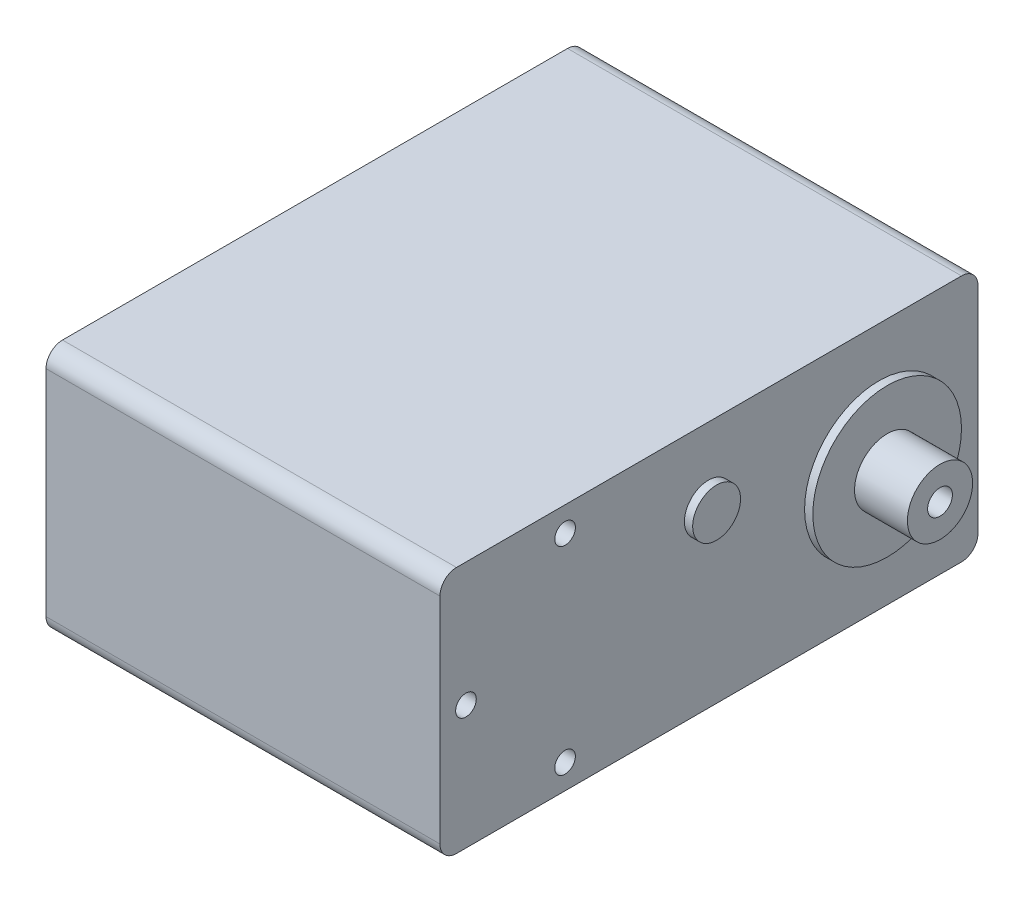
from build123d import *

# Parameters (mm, degrees)
ESQUISSE1_W                         = 47.7
ESQUISSE1_H                         = 65.15
BOSS_EXTRU_1_DEPTH                  = 15
ESQUISSE2_R                         = 9
BOSS_EXTRU_2_DEPTH                  = 1
ESQUISSE3_R                         = 3.95
BOSS_EXTRU_3_DEPTH                  = 6.4
ESQUISSE4_R                         = 4
BOSS_EXTRU_4_DEPTH                  = 0.5
ESQUISSE5_R                         = 3
BOSS_EXTRU_5_DEPTH                  = 5.5
ESQUISSE6_R                         = 2.9
BOSS_EXTRU_6_DEPTH                  = 1
ESQUISSE7_W                         = 4.4
ESQUISSE7_H                         = 6.9
BOSS_EXTRU_7_DEPTH                  = 3.8
ESQUISSE8_R                         = 0.75
BOSS_EXTRU_8_DEPTH                  = 5
DIAM_TRE_DU_PER_AGE_3_0_3_1_D       = 3
DIAM_TRE_DU_PER_AGE_3_0_3_1_DEPTH   = 6.2
DIAM_TRE_DU_PER_AGE_3_0_3_1_TIP     = 0.901290929
DIAM_TRE_DU_PER_AGE_2_5_2_5_1_D     = 2.5
DIAM_TRE_DU_PER_AGE_2_5_2_5_1_DEPTH = 6.2
DIAM_TRE_DU_PER_AGE_2_5_2_5_1_TIP   = 0.751075774
DIAM_TRE_DU_PER_AGE_2_5_2_5_2_D     = 2.5
DIAM_TRE_DU_PER_AGE_2_5_2_5_2_DEPTH = 6.2
DIAM_TRE_DU_PER_AGE_2_5_2_5_2_TIP   = 0.751075774
CONG_1_R                            = 2


with BuildPart() as part:
    # Esquisse1 → Boss.-Extru.1 (new, symmetric)
    with BuildSketch(Plane(origin=(0, 0, 0), x_dir=(1, 0, 0), z_dir=(0, 1, 0))):
        Rectangle(ESQUISSE1_W, ESQUISSE1_H)
    extrude(amount=BOSS_EXTRU_1_DEPTH, both=True)

    # Esquisse2 → Boss.-Extru.2 (add)
    with BuildSketch(Plane(origin=(23.85, 0, 0), x_dir=(0, 0, -1), z_dir=(1, 0, 0))):
        with Locations((20.575, 0)):
            Circle(ESQUISSE2_R)
    boss_extru_2 = extrude(amount=BOSS_EXTRU_2_DEPTH)

    # Symétrie1: Boss.-Extru.2 across plane
    add(boss_extru_2.mirror(Plane(origin=(0, 0, 0), x_dir=(0, 0, 1), z_dir=(1, 0, 0))))

    # Esquisse3 → Boss.-Extru.3 (add)
    with BuildSketch(Plane(origin=(24.85, 0, 0), x_dir=(0, 0, -1), z_dir=(1, 0, 0))):
        with Locations((20.575, 0)):
            Circle(ESQUISSE3_R)
    extrude(amount=BOSS_EXTRU_3_DEPTH)

    # Esquisse4 → Boss.-Extru.4 (add)
    with BuildSketch(Plane.ZY.offset(24.85)):
        with Locations((-20.575, 0)):
            Circle(ESQUISSE4_R)
    extrude(amount=BOSS_EXTRU_4_DEPTH)

    # Esquisse5 → Boss.-Extru.5 (add)
    with BuildSketch(Plane.ZY.offset(25.35)):
        with Locations((-20.575, 0)):
            Circle(ESQUISSE5_R)
    extrude(amount=BOSS_EXTRU_5_DEPTH)

    # Esquisse6 → Boss.-Extru.6 (add)
    with BuildSketch(Plane(origin=(23.85, 0, 0), x_dir=(0, 0, -1), z_dir=(1, 0, 0))):
        with Locations((-0.075, 6)):
            Circle(ESQUISSE6_R)
    extrude(amount=BOSS_EXTRU_6_DEPTH)

    # Esquisse7 → Boss.-Extru.7 (add)
    with BuildSketch(Plane(origin=(0, 0, -32.575), x_dir=(-1, 0, 0), z_dir=(0, 0, -1))):
        with Locations((15.25, 0)):
            Rectangle(ESQUISSE7_W, ESQUISSE7_H)
    extrude(amount=BOSS_EXTRU_7_DEPTH)

    # Esquisse8 → Boss.-Extru.8 (add)
    with BuildSketch(Plane(origin=(0, 0, -36.375), x_dir=(-1, 0, 0), z_dir=(0, 0, -1))):
        with Locations((15.25, 0)):
            Circle(ESQUISSE8_R)
        with Locations((15.25, -1.6)):
            Circle(ESQUISSE8_R)
        with Locations((15.25, 1.6)):
            Circle(ESQUISSE8_R)
    extrude(amount=BOSS_EXTRU_8_DEPTH)

    # Diamètre du perçage Ø3.0 (3)1
    with Locations(Plane(origin=(31.25, 0, 0), x_dir=(0, 0, -1), z_dir=(1, 0, 0))):
        with Locations((20.575, 0)):
            Hole(DIAM_TRE_DU_PER_AGE_3_0_3_1_D / 2, depth=DIAM_TRE_DU_PER_AGE_3_0_3_1_DEPTH)
            with Locations((0, 0, -(DIAM_TRE_DU_PER_AGE_3_0_3_1_DEPTH + DIAM_TRE_DU_PER_AGE_3_0_3_1_TIP / 2))):  # 118° drill point
                Cone(0, DIAM_TRE_DU_PER_AGE_3_0_3_1_D / 2, DIAM_TRE_DU_PER_AGE_3_0_3_1_TIP, mode=Mode.SUBTRACT)

    # Diamètre du perçage Ø2.5 (2.5)1
    with Locations(Plane(origin=(23.85, 0, 0), x_dir=(0, 0, -1), z_dir=(1, 0, 0))):
        with Locations((-29.425, 0), (-17.425, 12), (-17.425, -12)):
            Hole(DIAM_TRE_DU_PER_AGE_2_5_2_5_1_D / 2, depth=DIAM_TRE_DU_PER_AGE_2_5_2_5_1_DEPTH)
            with Locations((0, 0, -(DIAM_TRE_DU_PER_AGE_2_5_2_5_1_DEPTH + DIAM_TRE_DU_PER_AGE_2_5_2_5_1_TIP / 2))):  # 118° drill point
                Cone(0, DIAM_TRE_DU_PER_AGE_2_5_2_5_1_D / 2, DIAM_TRE_DU_PER_AGE_2_5_2_5_1_TIP, mode=Mode.SUBTRACT)

    # Diamètre du perçage Ø2.5 (2.5)2
    with Locations(Plane.ZY.offset(23.85)):
        with Locations((29.5, 12), (-29.5, 12), (29.5, -12), (-29.5, -12), (5.5, 12), (5.5, -12)):
            Hole(DIAM_TRE_DU_PER_AGE_2_5_2_5_2_D / 2, depth=DIAM_TRE_DU_PER_AGE_2_5_2_5_2_DEPTH)
            with Locations((0, 0, -(DIAM_TRE_DU_PER_AGE_2_5_2_5_2_DEPTH + DIAM_TRE_DU_PER_AGE_2_5_2_5_2_TIP / 2))):  # 118° drill point
                Cone(0, DIAM_TRE_DU_PER_AGE_2_5_2_5_2_D / 2, DIAM_TRE_DU_PER_AGE_2_5_2_5_2_TIP, mode=Mode.SUBTRACT)

    # Congé1
    cong_1_edges = [part.edges().sort_by_distance(p)[0] for p in [
        (0, 15, 32.575),
        (0, -15, 32.575),
        (0, 15, -32.575),
        (0, -15, -32.575),
    ]]
    fillet(cong_1_edges, radius=CONG_1_R)


solid = part.part
